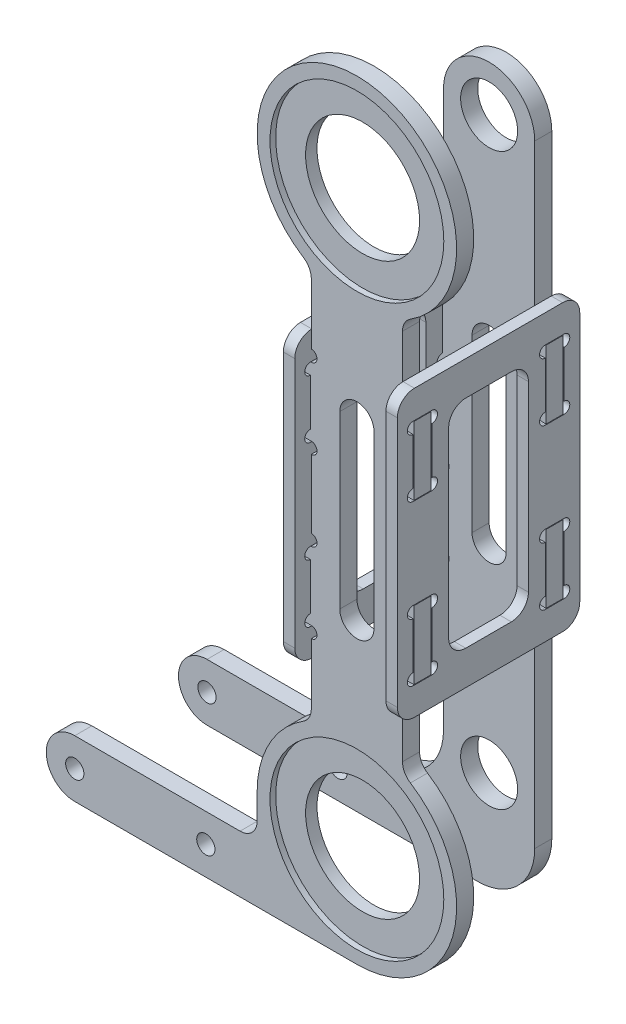
from build123d import *

# Parameters (mm, degrees)
EXTRUDE_START       = 10.1
SKETCH_1_R          = 1.6
SKETCH_1_R_2        = 10
EXTRUDE_1_DEPTH     = 3
SKETCH_6_R          = 15.25
CUT_EXTRUDE_1_DEPTH = 1
EXTRUDE_START_2     = -10.1
SKETCH_4_R          = 1.6
SKETCH_4_R_2        = 5
EXTRUDE_2_DEPTH     = 3
SKETCH_5_W          = 32
SKETCH_5_H          = 50
SKETCH_5_W_2        = 14
SKETCH_5_H_2        = 38
EXTRUDE_3_DEPTH     = 2
FILLET_1_R          = 3
FILLET_2_R          = 10
FILLET_3_R          = 3


with BuildPart() as part:
    # 草图1 → 凸台-拉伸1 (new body)
    with BuildSketch(Plane.XY.offset(EXTRUDE_START)):
        with BuildLine():
            Line((0, 5), (32, 5))
            Line((32, 5), (32, 12.5))
            ThreePointArc((32, 12.5), (34.562630754, 21.617291264), (41.5, 28.064382416))
            Line((41.5, 28.064382416), (41.5, 40.5))
            ThreePointArc((41.5, 40.5), (42.5, 41.5), (41.5, 42.5))
            Line((41.5, 42.5), (39.5, 42.5))
            Line((39.5, 42.5), (39.5, 54.5))
            Line((39.5, 54.5), (41.5, 54.5))
            ThreePointArc((41.5, 54.5), (42.5, 55.5), (41.5, 56.5))
            Line((41.5, 56.5), (41.5, 68.5))
            ThreePointArc((41.5, 68.5), (42.5, 69.5), (41.5, 70.5))
            Line((41.5, 70.5), (39.5, 70.5))
            Line((39.5, 70.5), (39.5, 82.5))
            Line((39.5, 82.5), (41.5, 82.5))
            ThreePointArc((41.5, 82.5), (42.5, 83.5), (41.5, 84.5))
            Line((41.5, 84.5), (41.5, 96.935617584))
            ThreePointArc((41.5, 96.935617584), (49.5, 130), (57.5, 96.935617584))
            Line((57.5, 96.935617584), (57.5, 84.5))
            ThreePointArc((57.5, 84.5), (56.5, 83.5), (57.5, 82.5))
            Line((57.5, 82.5), (59.5, 82.5))
            Line((59.5, 82.5), (59.5, 70.5))
            Line((59.5, 70.5), (57.5, 70.5))
            ThreePointArc((57.5, 70.5), (56.5, 69.5), (57.5, 68.5))
            Line((57.5, 68.5), (57.5, 56.5))
            ThreePointArc((57.5, 56.5), (56.5, 55.5), (57.5, 54.5))
            Line((57.5, 54.5), (59.5, 54.5))
            Line((59.5, 54.5), (59.5, 42.5))
            Line((59.5, 42.5), (57.5, 42.5))
            ThreePointArc((57.5, 42.5), (56.5, 41.5), (57.5, 40.5))
            Line((57.5, 40.5), (57.5, 28.064382416))
            ThreePointArc((57.5, 28.064382416), (66.509213566, 8.384583392), (49.5, -5))
            Line((49.5, -5), (0, -5))
            ThreePointArc((0, -5), (-5, 0), (0, 5))
        make_face()
        Circle(SKETCH_1_R, mode=Mode.SUBTRACT)
        with Locations((23, 0)):
            Circle(SKETCH_1_R, mode=Mode.SUBTRACT)
        with Locations((49.5, 12.5)):
            Circle(SKETCH_1_R_2, mode=Mode.SUBTRACT)
        with Locations((49.5, 112.5)):
            Circle(SKETCH_1_R_2, mode=Mode.SUBTRACT)
        with BuildLine():
            Line((46.5, 47.5), (46.5, 77.5))
            ThreePointArc((46.5, 77.5), (49.5, 80.5), (52.5, 77.5))
            Line((52.5, 77.5), (52.5, 47.5))
            ThreePointArc((52.5, 47.5), (49.5, 44.5), (46.5, 47.5))
        make_face(mode=Mode.SUBTRACT)
    extrude(amount=EXTRUDE_1_DEPTH)

    # 草图6 → 切除-拉伸1 (cut)
    with BuildSketch(Plane.XY.offset(13.1)):
        with Locations((49.5, 112.5)):
            Circle(SKETCH_6_R)
        with Locations((49.5, 12.5)):
            Circle(SKETCH_6_R)
    extrude(amount=-CUT_EXTRUDE_1_DEPTH, mode=Mode.SUBTRACT)

    # 圆角1
    fillet_1_edges = [part.edges().sort_by_distance(p)[0] for p in [
        (32, 5, 11.6),
        (41.5, 28.064382416, 11.6),
        (41.5, 96.935617584, 11.6),
        (57.5, 96.935617584, 11.6),
        (57.5, 28.064382416, 11.6),
    ]]
    fillet(fillet_1_edges, radius=FILLET_1_R)


with BuildPart() as body_2:
    # 草图4 → 凸台-拉伸2 (new body)
    with BuildSketch(Plane.XY.offset(EXTRUDE_START_2)):
        with BuildLine():
            Line((0, -5), (49.5, -5))
            ThreePointArc((49.5, -5), (53.615416608, -4.509213566), (57.5, -3.064382416))
            Line((57.5, -3.064382416), (57.5, 40.5))
            ThreePointArc((57.5, 40.5), (56.5, 41.5), (57.5, 42.5))
            Line((57.5, 42.5), (59.5, 42.5))
            Line((59.5, 42.5), (59.5, 54.5))
            Line((59.5, 54.5), (57.5, 54.5))
            ThreePointArc((57.5, 54.5), (56.5, 55.5), (57.5, 56.5))
            Line((57.5, 56.5), (57.5, 68.5))
            ThreePointArc((57.5, 68.5), (56.5, 69.5), (57.5, 70.5))
            Line((57.5, 70.5), (59.5, 70.5))
            Line((59.5, 70.5), (59.5, 82.5))
            Line((59.5, 82.5), (57.5, 82.5))
            ThreePointArc((57.5, 82.5), (56.5, 83.5), (57.5, 84.5))
            Line((57.5, 84.5), (57.5, 112.5))
            ThreePointArc((57.5, 112.5), (49.5, 120.5), (41.5, 112.5))
            Line((41.5, 112.5), (41.5, 84.5))
            ThreePointArc((41.5, 84.5), (42.5, 83.5), (41.5, 82.5))
            Line((41.5, 82.5), (39.5, 82.5))
            Line((39.5, 82.5), (39.5, 70.5))
            Line((39.5, 70.5), (41.5, 70.5))
            ThreePointArc((41.5, 70.5), (42.5, 69.5), (41.5, 68.5))
            Line((41.5, 68.5), (41.5, 56.5))
            ThreePointArc((41.5, 56.5), (42.5, 55.5), (41.5, 54.5))
            Line((41.5, 54.5), (39.5, 54.5))
            Line((39.5, 54.5), (39.5, 42.5))
            Line((39.5, 42.5), (41.5, 42.5))
            ThreePointArc((41.5, 42.5), (42.5, 41.5), (41.5, 40.5))
            Line((41.5, 40.5), (41.5, 5))
            Line((41.5, 5), (0, 5))
            ThreePointArc((0, 5), (-5, 0), (0, -5))
        make_face()
        Circle(SKETCH_4_R, mode=Mode.SUBTRACT)
        with Locations((23, 0)):
            Circle(SKETCH_4_R, mode=Mode.SUBTRACT)
        with Locations((49.5, 12.5)):
            Circle(SKETCH_4_R_2, mode=Mode.SUBTRACT)
        with Locations((49.5, 112.5)):
            Circle(SKETCH_4_R_2, mode=Mode.SUBTRACT)
        with BuildLine():
            Line((46.5, 47.5), (46.5, 77.5))
            ThreePointArc((46.5, 77.5), (49.5, 80.5), (52.5, 77.5))
            Line((52.5, 77.5), (52.5, 47.5))
            ThreePointArc((52.5, 47.5), (49.5, 44.5), (46.5, 47.5))
        make_face(mode=Mode.SUBTRACT)
    extrude(amount=-EXTRUDE_2_DEPTH)

    # 圆角2
    fillet_2_edges = [body_2.edges().sort_by_distance(p)[0] for p in [
        (41.5, 5, -11.6),
        (57.5, -3.064382416, -11.6),
    ]]
    fillet(fillet_2_edges, radius=FILLET_2_R)


with BuildPart() as body_3:
    # 草图5 → 凸台-拉伸3 (new body)
    with BuildSketch(Plane.ZY.offset(-39.5)):
        with Locations((0, 62.5)):
            Rectangle(SKETCH_5_W, SKETCH_5_H)
        with BuildLine():
            Line((13.25, 80.6), (13.25, 72.4))
            ThreePointArc((13.25, 72.4), (14.25, 71.4), (13.25, 70.4))
            Line((13.25, 70.4), (9.95, 70.4))
            ThreePointArc((9.95, 70.4), (8.95, 71.4), (9.95, 72.4))
            Line((9.95, 72.4), (9.95, 80.6))
            ThreePointArc((9.95, 80.6), (8.95, 81.6), (9.95, 82.6))
            Line((9.95, 82.6), (13.25, 82.6))
            ThreePointArc((13.25, 82.6), (14.25, 81.6), (13.25, 80.6))
        make_face(mode=Mode.SUBTRACT)
        with BuildLine():
            Line((-13.25, 82.6), (-9.95, 82.6))
            ThreePointArc((-9.95, 82.6), (-8.95, 81.6), (-9.95, 80.6))
            Line((-9.95, 80.6), (-9.95, 72.4))
            ThreePointArc((-9.95, 72.4), (-8.95, 71.4), (-9.95, 70.4))
            Line((-9.95, 70.4), (-13.25, 70.4))
            ThreePointArc((-13.25, 70.4), (-14.25, 71.4), (-13.25, 72.4))
            Line((-13.25, 72.4), (-13.25, 80.6))
            ThreePointArc((-13.25, 80.6), (-14.25, 81.6), (-13.25, 82.6))
        make_face(mode=Mode.SUBTRACT)
        with BuildLine():
            Line((-13.25, 44.4), (-13.25, 52.6))
            ThreePointArc((-13.25, 52.6), (-14.25, 53.6), (-13.25, 54.6))
            Line((-13.25, 54.6), (-9.95, 54.6))
            ThreePointArc((-9.95, 54.6), (-8.95, 53.6), (-9.95, 52.6))
            Line((-9.95, 52.6), (-9.95, 44.4))
            ThreePointArc((-9.95, 44.4), (-8.95, 43.4), (-9.95, 42.4))
            Line((-9.95, 42.4), (-13.25, 42.4))
            ThreePointArc((-13.25, 42.4), (-14.25, 43.4), (-13.25, 44.4))
        make_face(mode=Mode.SUBTRACT)
        with BuildLine():
            Line((13.25, 42.4), (9.95, 42.4))
            ThreePointArc((9.95, 42.4), (8.95, 43.4), (9.95, 44.4))
            Line((9.95, 44.4), (9.95, 52.6))
            ThreePointArc((9.95, 52.6), (8.95, 53.6), (9.95, 54.6))
            Line((9.95, 54.6), (13.25, 54.6))
            ThreePointArc((13.25, 54.6), (14.25, 53.6), (13.25, 52.6))
            Line((13.25, 52.6), (13.25, 44.4))
            ThreePointArc((13.25, 44.4), (14.25, 43.4), (13.25, 42.4))
        make_face(mode=Mode.SUBTRACT)
        with Locations((0, 62.5)):
            Rectangle(SKETCH_5_W_2, SKETCH_5_H_2, mode=Mode.SUBTRACT)
    extrude(amount=-EXTRUDE_3_DEPTH)

    # 圆角3
    fillet_3_edges = [body_3.edges().sort_by_distance(p)[0] for p in [
        (40.5, 81.5, 7),
        (40.5, 43.5, 7),
        (40.5, 43.5, -7),
        (40.5, 81.5, -7),
        (40.5, 37.5, 16),
        (40.5, 37.5, -16),
        (40.5, 87.5, -16),
        (40.5, 87.5, 16),
    ]]
    fillet(fillet_3_edges, radius=FILLET_3_R)


with BuildPart() as body_4:
    # 镜向1: mirrored copy
    add(body_3.part.mirror(Plane.ZY.offset(-49.5)))


solid = Compound([part.part, body_2.part, body_3.part, body_4.part])
